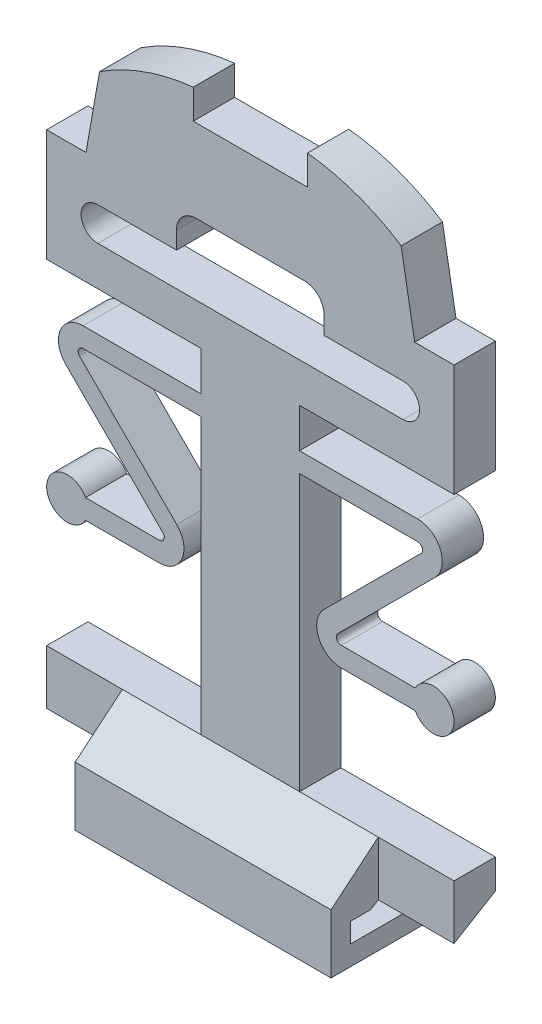
from build123d import *

# Parameters (mm, degrees)
Y_KSEKLIK_EKSTR_ZYON2_DEPTH = 2.1
Y_KSEKLIK_EKSTR_ZYON3_DEPTH = 10.35
KES_EKSTR_ZYON1_DEPTH       = 36.16052474
KES_EKSTR_ZYON2_DEPTH       = 3.85


with BuildPart() as part:
    # Çizim1 → Yükseklik-Ekstrüzyon2 (new body)
    with BuildSketch(Plane.XY):
        with BuildLine():
            Line((0, 0), (-10.35, 0))
            Line((-10.35, 0), (-10.35, 5))
            Line((-10.35, 5), (-2.5, 5))
            Line((-2.5, 5), (-2.5, 19))
            Line((-2.5, 19), (-8.5, 19))
            ThreePointArc((-8.5, 19), (-8.730969883, 18.845670858), (-8.676776695, 18.573223305))
            Line((-8.676776695, 18.573223305), (-3.737436867, 13.633883476))
            ThreePointArc((-3.737436867, 13.633883476), (-3.466470928, 12.27164571), (-4.621320344, 11.5))
            Line((-4.621320344, 11.5), (-8.376690734, 11.5))
            ThreePointArc((-8.376690734, 11.5), (-10.35, 12), (-8.376690734, 12.5))
            Line((-8.376690734, 12.5), (-4.621320344, 12.5))
            ThreePointArc((-4.621320344, 12.5), (-4.39035046, 12.654329142), (-4.444543648, 12.926776695))
            Line((-4.444543648, 12.926776695), (-9.383883476, 17.866116524))
            ThreePointArc((-9.383883476, 17.866116524), (-9.654849416, 19.22835429), (-8.5, 20))
            Line((-8.5, 20), (-2.5, 20))
            Line((-2.5, 20), (-2.5, 22))
            Line((-2.5, 22), (-10.35, 22))
            Line((-10.35, 22), (-10.35, 27.7))
            Line((-10.35, 27.7), (-8.35, 27.7))
            Line((-8.35, 27.7), (-7.662324775, 31.6))
            ThreePointArc((-7.662324775, 31.6), (-5.382058591, 32.732647346), (-2.9, 33.3))
            Line((-2.9, 33.3), (-2.9, 31.8))
            Line((-2.9, 31.8), (0, 31.8))
            Line((0, 31.8), (0, 27.6))
            Line((0, 27.6), (-2.75, 27.6))
            ThreePointArc((-2.75, 27.6), (-3.457106781, 27.307106781), (-3.75, 26.6))
            Line((-3.75, 26.6), (-3.75, 25.7))
            Line((-3.75, 25.7), (-7.75, 25.7))
            ThreePointArc((-7.75, 25.7), (-8.6, 24.85), (-7.75, 24))
            Line((-7.75, 24), (0, 24))
            Line((0, 24), (0, 0))
        make_face()
    extrude(amount=Y_KSEKLIK_EKSTR_ZYON2_DEPTH)

    # Çizim2 → Yükseklik-Ekstrüzyon3 (add, through all)
    with BuildSketch(Plane(origin=(0, 0, 0), x_dir=(0, 0, -1), z_dir=(1, 0, 0))):
        Polygon((0, 5), (0, 3.5), (-2.5, 2), (-3.5, 2), (-3.5, 1), (2.5, 1), (2.5, 0), (-4.5, 0), (-4.5, 3), (-2.1, 5), align=None)
    extrude(amount=-Y_KSEKLIK_EKSTR_ZYON3_DEPTH)

    # Çizim2<3> → Kes-Ekstrüzyon1 (cut, through all)
    with BuildSketch(Plane(origin=(0, 0, 0), x_dir=(0, 0, -1), z_dir=(1, 0, 0))):
        Polygon((0, 3.5), (2.5, 1), (-3.5, 1), (-3.5, 2), (-2.5, 2), align=None)
    extrude(amount=-KES_EKSTR_ZYON1_DEPTH, mode=Mode.SUBTRACT)

    # Çizim3 → Kes-Ekstrüzyon2 (cut)
    with BuildSketch(Plane.ZY.offset(10.35)):
        Polygon((4.5, 3), (2.1, 5), (2.1, 2.24), (2.5, 2), (3.5, 2), (3.5, 1), (-2.5, 1), (-2.5, 0), (4.5, 0), align=None)
    extrude(amount=-KES_EKSTR_ZYON2_DEPTH, mode=Mode.SUBTRACT)

    # Aynalama1: part across plane


with BuildPart() as part_1:
    add(part.part)
    add(part.part.mirror(Plane(origin=(0, 24, 2.1), x_dir=(0, 0, 1), z_dir=(1, 0, 0))))


solid = part_1.part
